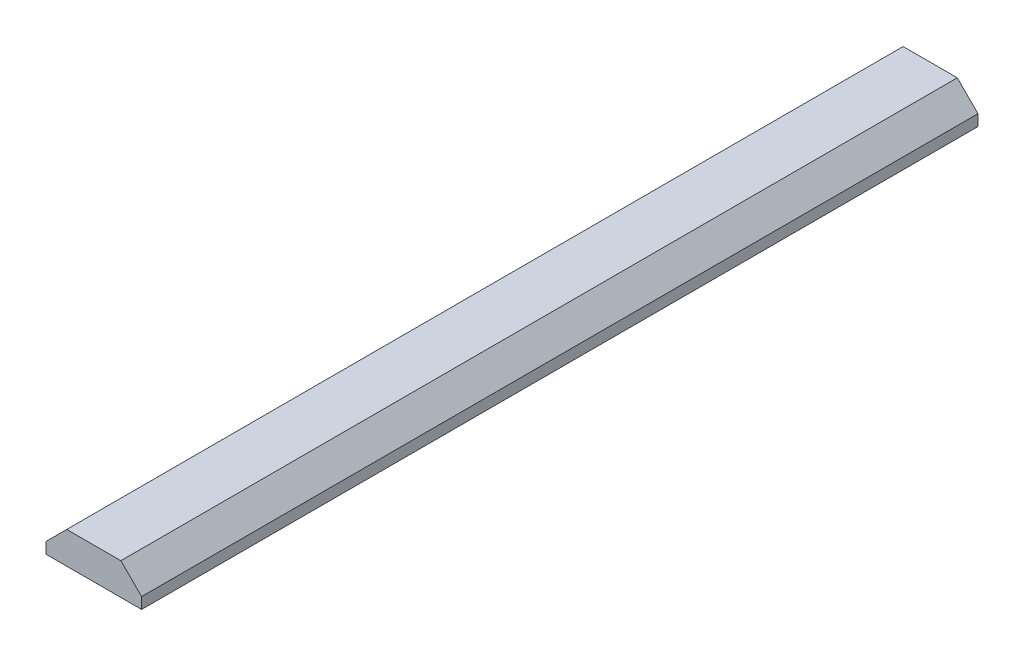
from build123d import *

# Parameters (mm, degrees)
AUFSATZ_LINEAR_AUSTRAGEN1_DEPTH = 105


with BuildPart() as part:
    # Skizze1 → Aufsatz-Linear austragen1 (new body)
    with BuildSketch(Plane.XY):
        Polygon((3.4, 1.808858787), (-3.4, 1.808858787), (-6, -0.791141213), (-6, -2.191141213), (6, -2.191141213), (6, -0.791141213), align=None)
    extrude(amount=AUFSATZ_LINEAR_AUSTRAGEN1_DEPTH)


solid = part.part
